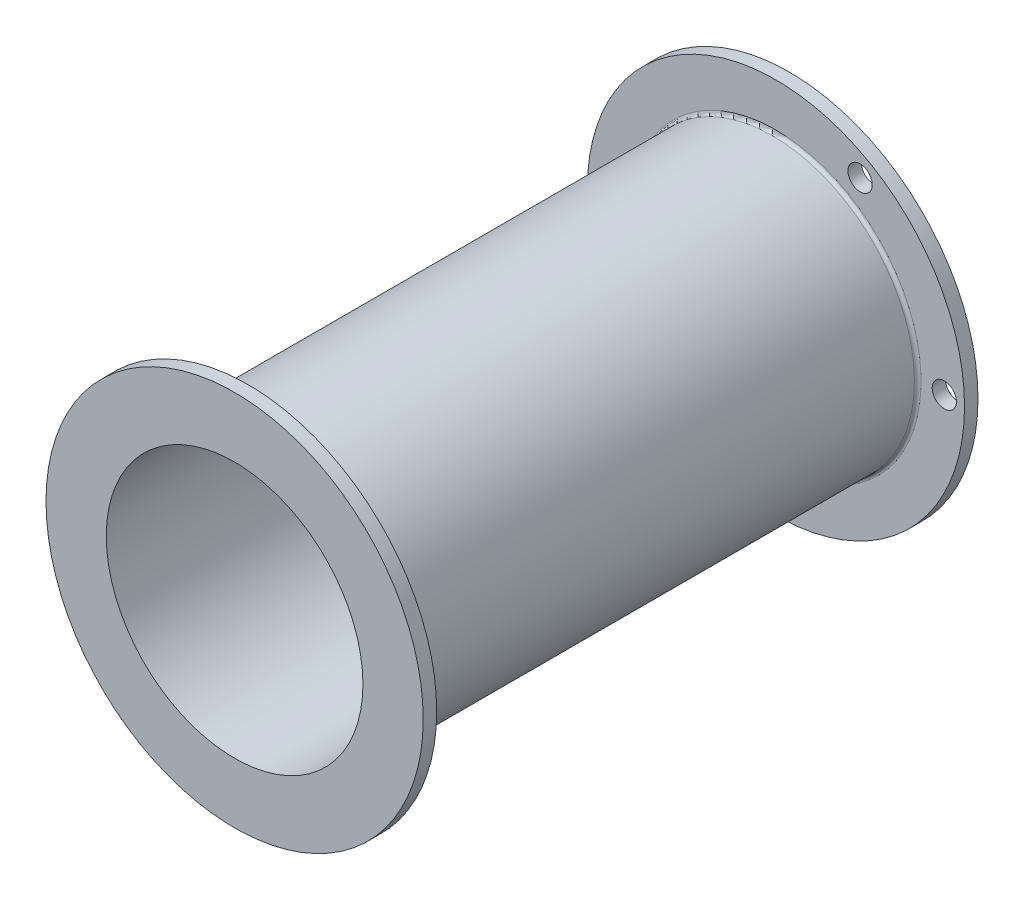
from build123d import *
from build123d.topology import SkipClean

# Parameters (mm, degrees)
SKETCH1_R           = 10.525
SKETCH1_R_2         = 9.525
BOSS_EXTRUDE1_DEPTH = 40.18
BOSS_EXTRUDE2_START = 1
SKETCH2_R           = 14
SKETCH2_R_2         = 9.525
BOSS_EXTRUDE2_DEPTH = 1
CIRPATTERN1_COUNT   = 6
FILLET1_R           = 0.25


with BuildPart() as part:
    # Sketch1 → Boss-Extrude1 (new body)
    with BuildSketch(Plane.XY):
        Circle(SKETCH1_R)
        Circle(SKETCH1_R_2, mode=Mode.SUBTRACT)
    extrude(amount=BOSS_EXTRUDE1_DEPTH)

    # Sketch2 → Boss-Extrude2 (add)
    with SkipClean():  # the faces are left unmerged after this step: merging them gives an invalid solid
        with BuildSketch(Plane(origin=(0, 0, 0), x_dir=(-1, 0, 0), z_dir=(0, 0, -1)).offset(BOSS_EXTRUDE2_START)):
            Circle(SKETCH2_R)
            Circle(SKETCH2_R_2, mode=Mode.SUBTRACT)
        boss_extrude2 = extrude(amount=-BOSS_EXTRUDE2_DEPTH)

    # Sketch11 → M1.6 Clearance Hole1 (revolve, cut)
    with SkipClean():  # the faces are left unmerged after this step: merging them gives an invalid solid
        with BuildSketch(Plane(origin=(-12.5, 0, 0), x_dir=(0, -1, 0), z_dir=(1, 0, 0))):
            Polygon((0, 0), (0, 5.540774557), (0.9, 5), (0.9, 0), align=None)
        m1_6_clearance_hole1 = revolve(axis=Axis((-12.5, 0, 6.35), (0, 0, -1)), mode=Mode.SUBTRACT)

    # CirPattern1: M1.6 Clearance Hole1 ×6 about axis, 2 skipped
    with SkipClean():  # the faces are left unmerged after this step: merging them gives an invalid solid
        cirpattern1_axis = Axis((0, 0, 0), (0, 0, -1))
        add([m1_6_clearance_hole1.rotate(cirpattern1_axis, i * 360 / CIRPATTERN1_COUNT) for i in range(1, CIRPATTERN1_COUNT) if i not in (1, 4)], mode=Mode.SUBTRACT)

    # Fillet1
    fillet1_edges = [part.edges().sort_by_distance(p)[0] for p in [
        (-10.525, 0, 0),
    ]]
    fillet(fillet1_edges, radius=FILLET1_R)

    # Mirror1: Boss-Extrude2 across plane
    add(boss_extrude2.mirror(Plane.XY.offset(19.59)))


solid = part.part
